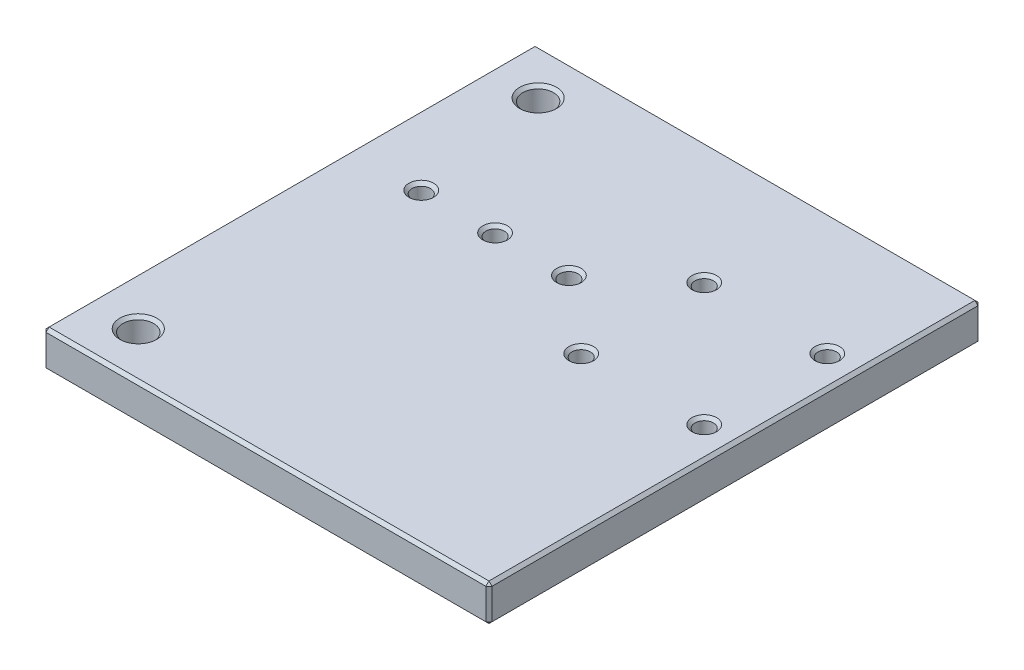
from build123d import *

# Parameters (mm, degrees)
CROQUIS1_W              = 72.5
CROQUIS1_H              = 80
CROQUIS1_R              = 1.5
CROQUIS1_R_2            = 2.5
SALIENTE_EXTRUIR1_DEPTH = 6
CHAFL_N1_SIZE           = 0.5


with BuildPart() as part:
    # Croquis1 → Saliente-Extruir1 (new body)
    with BuildSketch(Plane(origin=(0, 0, 0), x_dir=(1, 0, 0), z_dir=(0, 1, 0))):
        with Locations((5.730956658, -13.721461187)):
            Rectangle(CROQUIS1_W, CROQUIS1_H)
        with Locations(Location((16.980956658, 6.278538813, 0), (0, 0, 270))):
            Circle(CROQUIS1_R, mode=Mode.SUBTRACT)
        with Locations(Location((36.980956658, 6.278538813, 0), (0, 0, 270))):
            Circle(CROQUIS1_R, mode=Mode.SUBTRACT)
        with Locations(Location((16.980956658, -13.721461187, 0), (0, 0, 270))):
            Circle(CROQUIS1_R, mode=Mode.SUBTRACT)
        with Locations(Location((36.980956658, -13.721461187, 0), (0, 0, 270))):
            Circle(CROQUIS1_R, mode=Mode.SUBTRACT)
        with Locations(Location((-7.019043342, -3.721461187, 0), (0, 0, 270))):
            Circle(CROQUIS1_R, mode=Mode.SUBTRACT)
        with Locations(Location((4.980956658, -3.721461187, 0), (0, 0, 270))):
            Circle(CROQUIS1_R, mode=Mode.SUBTRACT)
        with Locations(Location((-22.519043342, 18.778538813, 0), (0, 0, 270))):
            Circle(CROQUIS1_R_2, mode=Mode.SUBTRACT)
        with Locations(Location((-22.519043342, -46.221461187, 0), (0, 0, 270))):
            Circle(CROQUIS1_R_2, mode=Mode.SUBTRACT)
        with Locations(Location((-19.019043342, -3.721461187, 0), (0, 0, 270))):
            Circle(CROQUIS1_R, mode=Mode.SUBTRACT)
    extrude(amount=SALIENTE_EXTRUIR1_DEPTH)

    # Chaflán1
    chafl_n1_edges = [part.edges().sort_by_distance(p)[0] for p in [
        (41.980956658, 6, 13.721461187),
        (16.980956658, 0, -7.778538813),
        (16.980956658, 6, -7.778538813),
        (5.730956658, 6, -26.278538813),
        (36.980956658, 0, -7.778538813),
        (36.980956658, 6, -7.778538813),
        (16.980956658, 0, 12.221461187),
        (16.980956658, 6, 12.221461187),
        (36.980956658, 0, 12.221461187),
        (36.980956658, 6, 12.221461187),
        (-7.019043342, 0, 2.221461187),
        (-7.019043342, 6, 2.221461187),
        (4.980956658, 0, 2.221461187),
        (4.980956658, 6, 2.221461187),
        (-22.519043342, 0, -21.278538813),
        (-22.519043342, 6, -21.278538813),
        (-22.519043342, 0, 43.721461187),
        (-22.519043342, 6, 43.721461187),
        (-30.519043342, 6, 13.721461187),
        (-19.019043342, 0, 2.221461187),
        (-19.019043342, 6, 2.221461187),
        (5.730956658, 0, -26.278538813),
        (41.980956658, 0, 13.721461187),
        (5.730956658, 0, 53.721461187),
        (-30.519043342, 0, 13.721461187),
        (5.730956658, 6, 53.721461187),
        (-30.519043342, 3, -26.278538813),
        (41.980956658, 3, -26.278538813),
        (41.980956658, 3, 53.721461187),
        (-30.519043342, 3, 53.721461187),
    ]]
    chamfer(chafl_n1_edges, length=CHAFL_N1_SIZE)


solid = part.part
